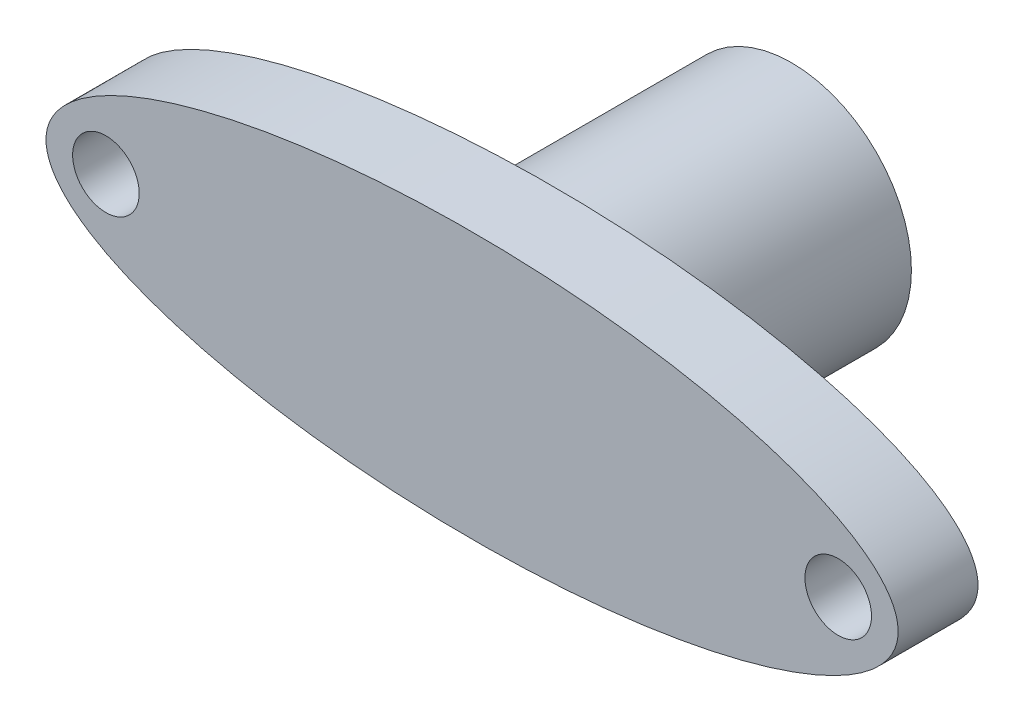
from build123d import *

# Parameters (mm, degrees)
SKETCH1_RX           = 800
SKETCH1_RY           = 250
SKETCH1_R            = 62.5
BOSS_EXTRUDE1_DEPTH  = 150
BOSS_EXTRUDE9_DEPTH  = 150
SKETCH17_R           = 225
BOSS_EXTRUDE13_DEPTH = 450


with BuildPart() as part:
    # Sketch1 → Boss-Extrude1 (new body)
    with BuildSketch(Plane.XY):
        with Locations((-931.832148188, 736.166079396)):
            Ellipse(SKETCH1_RX, SKETCH1_RY)
        with Locations((-1619.332148188, 736.166079396)):
            Circle(SKETCH1_R, mode=Mode.SUBTRACT)
        with Locations((-244.332148188, 736.166079396)):
            Circle(SKETCH1_R, mode=Mode.SUBTRACT)
    extrude(amount=BOSS_EXTRUDE1_DEPTH)

    # Sketch12 → Boss-Extrude9 (add)
    with BuildSketch(Plane(origin=(0, 0, 0), x_dir=(-1, 0, 0), z_dir=(0, 0, -1))):
        Polygon((991.0872246, 633.924307933), (1050.003657809, 736.361595141), (990.748581397, 838.603366603), (872.577071776, 838.407850859), (813.660638567, 735.970563652), (872.915714979, 633.728792189), align=None)
    extrude(amount=BOSS_EXTRUDE9_DEPTH)

    # Sketch17 → Boss-Extrude13 (add)
    with BuildSketch(Plane(origin=(0, 0, 0), x_dir=(-1, 0, 0), z_dir=(0, 0, -1))):
        with Locations(Location((931.832148188, 736.166079396, 0), (0, 0, 180))):
            Circle(SKETCH17_R)
        Polygon((991.0872246, 633.924307933), (1050.003657809, 736.361595141), (990.748581397, 838.603366603), (872.577071776, 838.407850859), (813.660638567, 735.970563652), (872.915714979, 633.728792189), align=None, mode=Mode.SUBTRACT)
    extrude(amount=BOSS_EXTRUDE13_DEPTH)


solid = part.part
